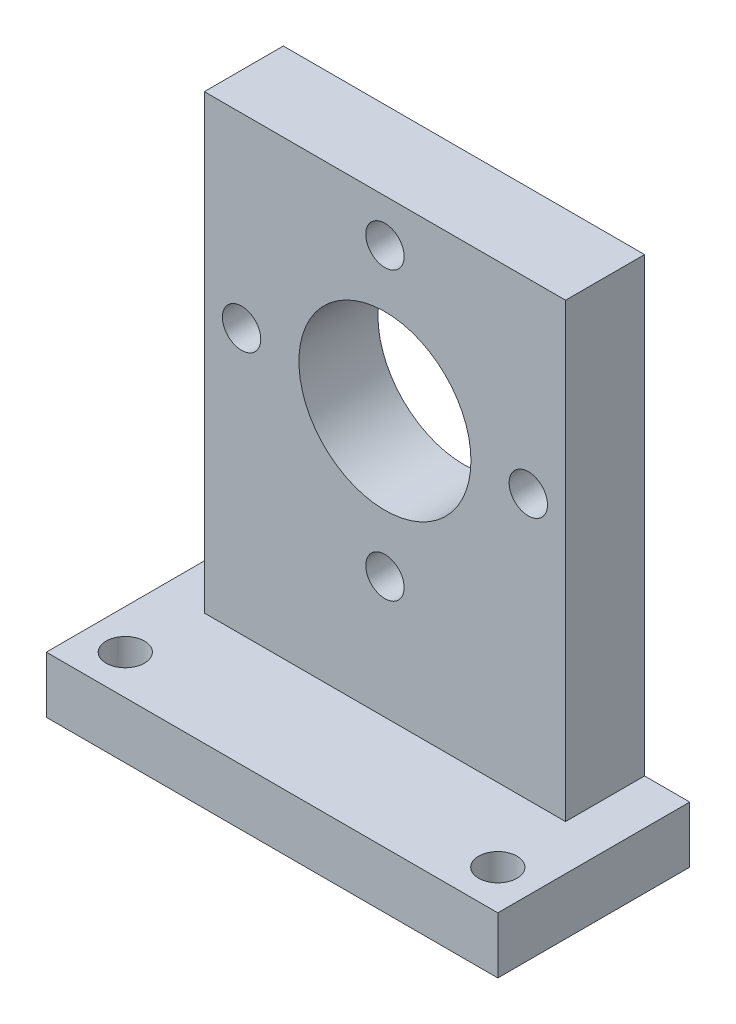
from build123d import *

# Parameters (mm, degrees)
SKETCH1_W           = 40
SKETCH1_H           = 27
SKETCH1_W_2         = 32
SKETCH1_H_2         = 7
BOSS_EXTRUDE1_DEPTH = 5
SKETCH1_3_W         = 32
SKETCH1_3_H         = 7
BOSS_EXTRUDE2_DEPTH = 45
CUT_EXTRUDE1_REACH  = 54.096
SKETCH2_R           = 7.62
CUT_EXTRUDE2_REACH  = 54.096
SKETCH4_R           = 1.7
CUT_EXTRUDE3_REACH  = 48.715
SKETCH5_R           = 1.7
CUT_EXTRUDE5_REACH  = 48.715
SKETCH7_W           = 40
SKETCH7_H           = 10
SKETCH8_R           = 1.7
CUT_EXTRUDE6_DEPTH  = 6.35


with BuildPart() as part:
    # Sketch1 → Boss-Extrude1 (new body)
    with BuildSketch(Plane(origin=(0, 0, 0), x_dir=(1, 0, 0), z_dir=(0, 1, 0))):
        Rectangle(SKETCH1_W, SKETCH1_H)
        Rectangle(SKETCH1_W_2, SKETCH1_H_2, mode=Mode.SUBTRACT)
    extrude(amount=BOSS_EXTRUDE1_DEPTH)

    # Sketch1<3> → Boss-Extrude2 (add)
    with BuildSketch(Plane(origin=(0, 0, 0), x_dir=(1, 0, 0), z_dir=(0, 1, 0))):
        Rectangle(SKETCH1_3_W, SKETCH1_3_H)
    extrude(amount=BOSS_EXTRUDE2_DEPTH)

    # Sketch2 → Cut-Extrude1 (cut, up to next)
    with BuildSketch(Plane.XY.offset(3.5), mode=Mode.PRIVATE) as cut_extrude1_sk1:
        with Locations((0, 28.5)):
            Circle(SKETCH2_R)
    cut_extrude1_tool1 = extrude(cut_extrude1_sk1.sketch, amount=-CUT_EXTRUDE1_REACH, mode=Mode.PRIVATE) & part.part
    add(cut_extrude1_tool1.solids().sort_by_distance((0, 28.5, 3.5))[0], mode=Mode.SUBTRACT)

    # Sketch4 → Cut-Extrude2 (cut, up to next)
    with BuildSketch(Plane.XY.offset(3.5), mode=Mode.PRIVATE) as cut_extrude2_sk1:
        with Locations((0, 41.2)):
            Circle(SKETCH4_R)
    cut_extrude2_tool1 = extrude(cut_extrude2_sk1.sketch, amount=-CUT_EXTRUDE2_REACH, mode=Mode.PRIVATE) & part.part
    # Sketch4 → Cut-Extrude2 (cut, up to next)
    with BuildSketch(Plane.XY.offset(3.5), mode=Mode.PRIVATE) as cut_extrude2_sk2:
        with Locations((12.7, 28.5)):
            Circle(SKETCH4_R)
    cut_extrude2_tool2 = extrude(cut_extrude2_sk2.sketch, amount=-CUT_EXTRUDE2_REACH, mode=Mode.PRIVATE) & part.part
    # Sketch4 → Cut-Extrude2 (cut, up to next)
    with BuildSketch(Plane.XY.offset(3.5), mode=Mode.PRIVATE) as cut_extrude2_sk3:
        with Locations((0, 15.8)):
            Circle(SKETCH4_R)
    cut_extrude2_tool3 = extrude(cut_extrude2_sk3.sketch, amount=-CUT_EXTRUDE2_REACH, mode=Mode.PRIVATE) & part.part
    # Sketch4 → Cut-Extrude2 (cut, up to next)
    with BuildSketch(Plane.XY.offset(3.5), mode=Mode.PRIVATE) as cut_extrude2_sk4:
        with Locations((-12.7, 28.5)):
            Circle(SKETCH4_R)
    cut_extrude2_tool4 = extrude(cut_extrude2_sk4.sketch, amount=-CUT_EXTRUDE2_REACH, mode=Mode.PRIVATE) & part.part
    add(cut_extrude2_tool1.solids().sort_by_distance((0, 41.2, 3.5))[0], mode=Mode.SUBTRACT)
    add(cut_extrude2_tool2.solids().sort_by_distance((12.7, 28.5, 3.5))[0], mode=Mode.SUBTRACT)
    add(cut_extrude2_tool3.solids().sort_by_distance((0, 15.8, 3.5))[0], mode=Mode.SUBTRACT)
    add(cut_extrude2_tool4.solids().sort_by_distance((-12.7, 28.5, 3.5))[0], mode=Mode.SUBTRACT)

    # Sketch5 → Cut-Extrude3 (cut, up to next)
    with BuildSketch(Plane(origin=(0, 5, 0), x_dir=(1, 0, 0), z_dir=(0, 1, 0)), mode=Mode.PRIVATE) as cut_extrude3_sk1:
        with Locations((-16.5, 10)):
            Circle(SKETCH5_R)
    cut_extrude3_tool1 = extrude(cut_extrude3_sk1.sketch, amount=-CUT_EXTRUDE3_REACH, mode=Mode.PRIVATE) & part.part
    # Sketch5 → Cut-Extrude3 (cut, up to next)
    with BuildSketch(Plane(origin=(0, 5, 0), x_dir=(1, 0, 0), z_dir=(0, 1, 0)), mode=Mode.PRIVATE) as cut_extrude3_sk2:
        with Locations((-16.5, -10)):
            Circle(SKETCH5_R)
    cut_extrude3_tool2 = extrude(cut_extrude3_sk2.sketch, amount=-CUT_EXTRUDE3_REACH, mode=Mode.PRIVATE) & part.part
    # Sketch5 → Cut-Extrude3 (cut, up to next)
    with BuildSketch(Plane(origin=(0, 5, 0), x_dir=(1, 0, 0), z_dir=(0, 1, 0)), mode=Mode.PRIVATE) as cut_extrude3_sk3:
        with Locations((16.5, -10)):
            Circle(SKETCH5_R)
    cut_extrude3_tool3 = extrude(cut_extrude3_sk3.sketch, amount=-CUT_EXTRUDE3_REACH, mode=Mode.PRIVATE) & part.part
    # Sketch5 → Cut-Extrude3 (cut, up to next)
    with BuildSketch(Plane(origin=(0, 5, 0), x_dir=(1, 0, 0), z_dir=(0, 1, 0)), mode=Mode.PRIVATE) as cut_extrude3_sk4:
        with Locations((16.5, 10)):
            Circle(SKETCH5_R)
    cut_extrude3_tool4 = extrude(cut_extrude3_sk4.sketch, amount=-CUT_EXTRUDE3_REACH, mode=Mode.PRIVATE) & part.part
    add(cut_extrude3_tool1.solids().sort_by_distance((-16.5, 5, -10))[0], mode=Mode.SUBTRACT)
    add(cut_extrude3_tool2.solids().sort_by_distance((-16.5, 5, 10))[0], mode=Mode.SUBTRACT)
    add(cut_extrude3_tool3.solids().sort_by_distance((16.5, 5, 10))[0], mode=Mode.SUBTRACT)
    add(cut_extrude3_tool4.solids().sort_by_distance((16.5, 5, -10))[0], mode=Mode.SUBTRACT)

    # Sketch7 → Cut-Extrude5 (cut, up to next)
    with BuildSketch(Plane(origin=(0, 5, 0), x_dir=(1, 0, 0), z_dir=(0, 1, 0)), mode=Mode.PRIVATE) as cut_extrude5_sk1:
        with Locations((0, 8.5)):
            Rectangle(SKETCH7_W, SKETCH7_H)
    cut_extrude5_tool1 = extrude(cut_extrude5_sk1.sketch, amount=-CUT_EXTRUDE5_REACH, mode=Mode.PRIVATE) & part.part
    add(cut_extrude5_tool1.solids().sort_by_distance((0, 5, -8.5))[0], mode=Mode.SUBTRACT)

    # Sketch8 → Cut-Extrude6 (cut)
    with BuildSketch(Plane(origin=(0, 0, -3.5), x_dir=(-1, 0, 0), z_dir=(0, 0, -1))):
        with Locations((-12.7, 2.5)):
            Circle(SKETCH8_R)
        with Locations((12.7, 2.5)):
            Circle(SKETCH8_R)
    extrude(amount=-CUT_EXTRUDE6_DEPTH, mode=Mode.SUBTRACT)


solid = part.part
